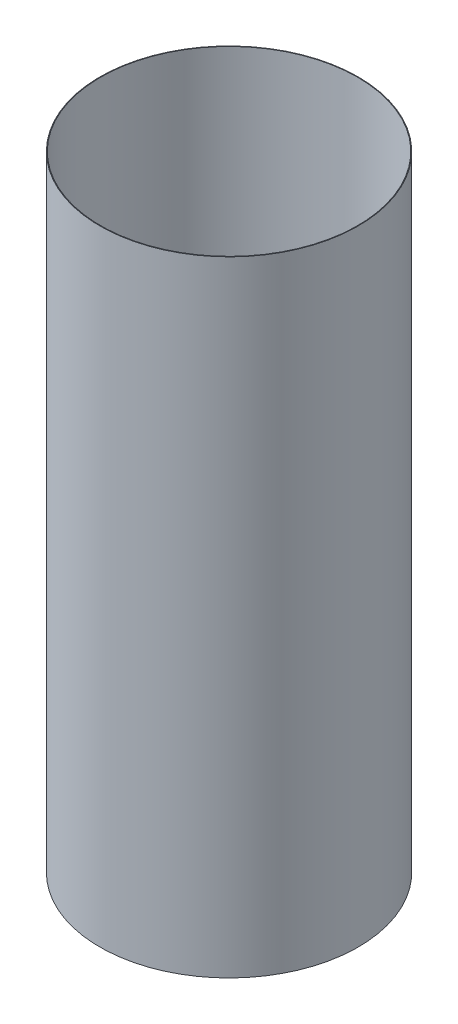
from build123d import *

# Parameters (mm, degrees)
SKETCH1_R           = 36.449
SKETCH1_R_2         = 36.2712
BOSS_EXTRUDE1_DEPTH = 176.2125


with BuildPart() as part:
    # Sketch1 → Boss-Extrude1 (new body)
    with BuildSketch(Plane(origin=(0, 0, 0), x_dir=(1, 0, 0), z_dir=(0, 1, 0))):
        with Locations(Location((0, 0, 0), (0, 0, 90))):
            Circle(SKETCH1_R)
        with Locations(Location((0, 0, 0), (0, 0, 90))):
            Circle(SKETCH1_R_2, mode=Mode.SUBTRACT)
    extrude(amount=BOSS_EXTRUDE1_DEPTH)


solid = part.part
